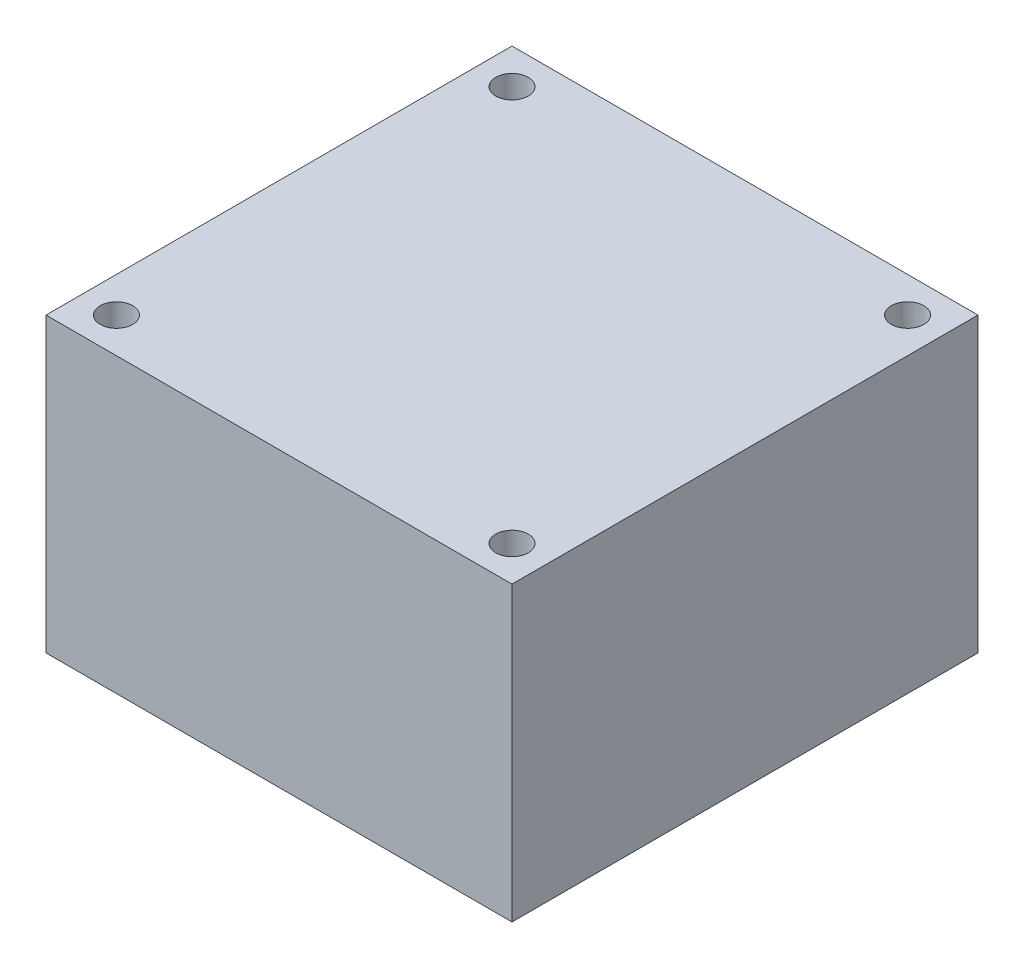
from build123d import *

# Parameters (mm, degrees)
SKETCH_1_W      = 43
SKETCH_1_H      = 43
SKETCH_1_R      = 1.5
EXTRUDE_1_DEPTH = 27


with BuildPart() as part:
    # 草图1 → 凸台-拉伸1 (new body)
    with BuildSketch(Plane(origin=(0, 0, 0), x_dir=(1, 0, 0), z_dir=(0, 1, 0))):
        Rectangle(SKETCH_1_W, SKETCH_1_H)
        with Locations(Location((-18.25, 18.25, 0), (0, 0, 270))):
            Circle(SKETCH_1_R, mode=Mode.SUBTRACT)
        with Locations(Location((18.25, 18.25, 0), (0, 0, 270))):
            Circle(SKETCH_1_R, mode=Mode.SUBTRACT)
        with Locations(Location((-18.25, -18.25, 0), (0, 0, 270))):
            Circle(SKETCH_1_R, mode=Mode.SUBTRACT)
        with Locations(Location((18.25, -18.25, 0), (0, 0, 270))):
            Circle(SKETCH_1_R, mode=Mode.SUBTRACT)
    extrude(amount=EXTRUDE_1_DEPTH)


solid = part.part
